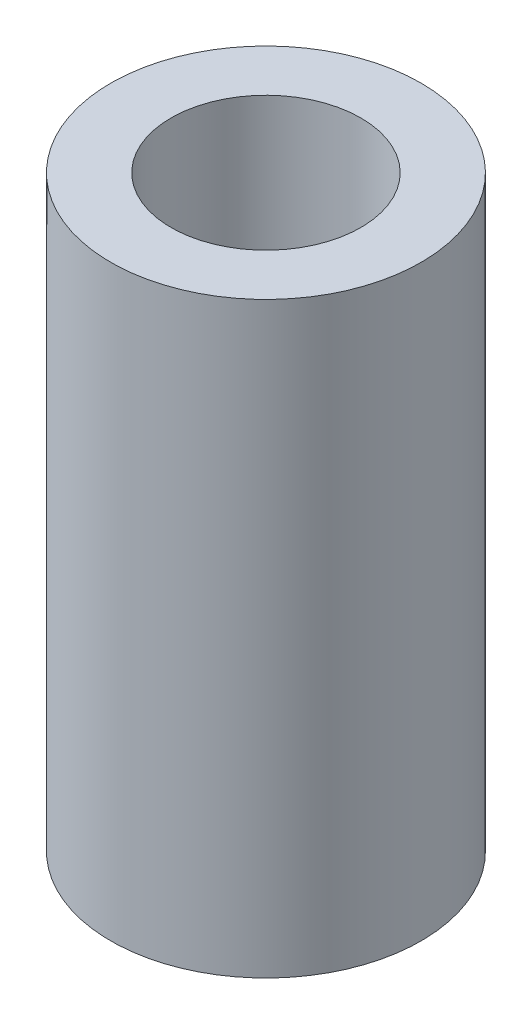
from build123d import *


with BuildPart() as part:
    # Skizze1 → Rotation1 (revolve)
    with BuildSketch(Plane.XY, mode=Mode.PRIVATE) as rotation1_sk:
        Polygon((-4.35, 0), (-4.35, 9.25), (0, 9.25), (0, 10.25), (-3.15, 10.25), (-3.15, 19.5), (-5.15, 19.5), (-5.15, 0), align=None)
    revolve(rotation1_sk.sketch.rotate(Axis((0, 0, 0), (0, 1, 0)), 270), axis=Axis((0, 0, 0), (0, 1, 0)))


solid = part.part
